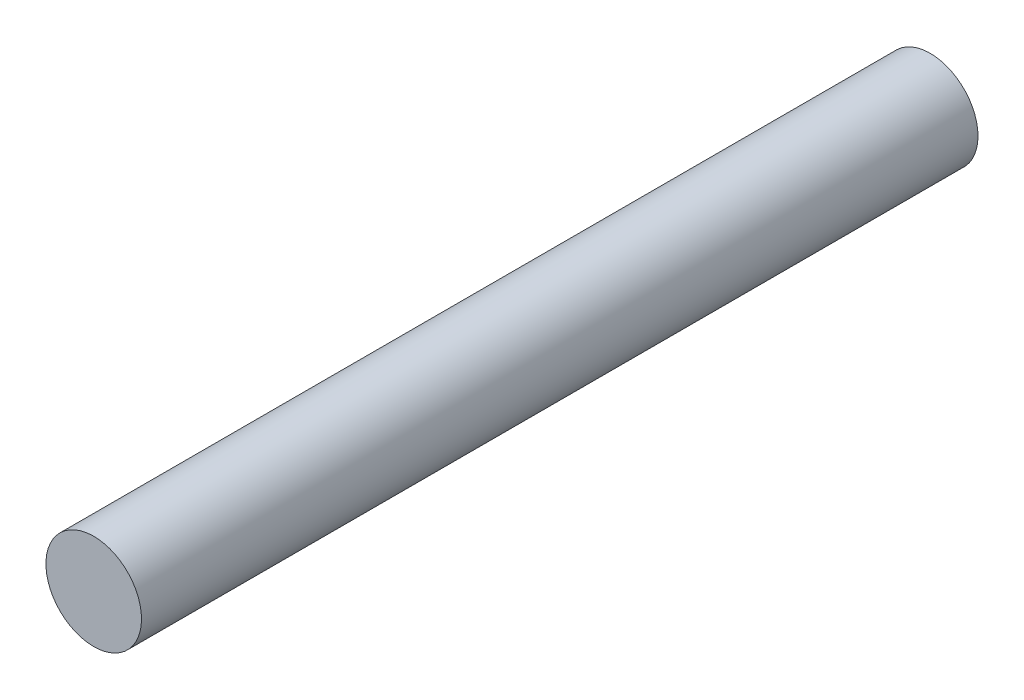
from build123d import *

# Parameters (mm, degrees)
SKETCH1_R           = 4
BOSS_EXTRUDE2_DEPTH = 70


with BuildPart() as part:
    # Sketch1 → Boss-Extrude2 (new body)
    with BuildSketch(Plane.XY):
        with Locations((67.255013498, 46.797562383)):
            Circle(SKETCH1_R)
    extrude(amount=BOSS_EXTRUDE2_DEPTH)


solid = part.part
